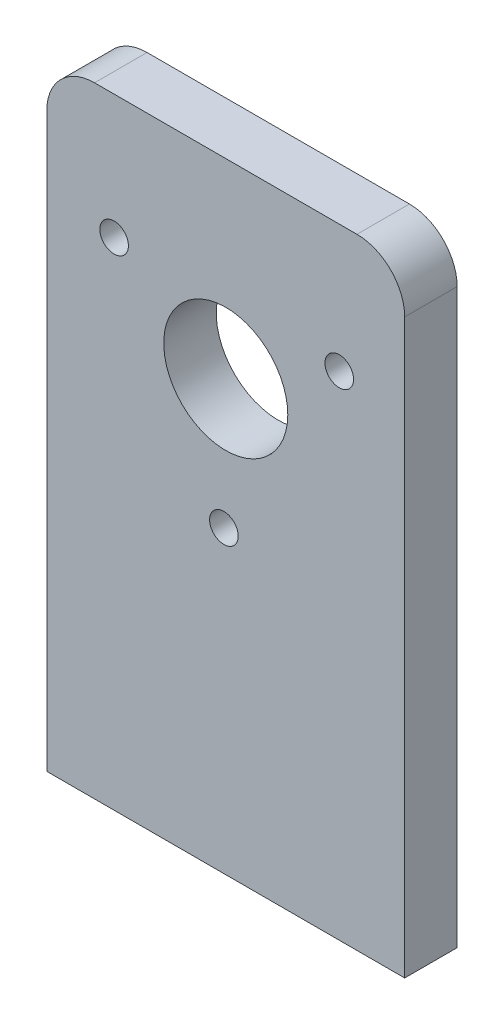
from build123d import *

# Parameters (mm, degrees)
SKETCH2_R           = 13
SKETCH2_R_2         = 3
BOSS_EXTRUDE1_DEPTH = 11


with BuildPart() as part:
    # Sketch2 → Boss-Extrude1 (new body)
    with BuildSketch(Plane.XY):
        with BuildLine():
            Line((0, 0), (75, 0))
            Line((75, 0), (75, 120))
            ThreePointArc((75, 120), (72.071067812, 127.071067812), (65, 130))
            Line((65, 130), (10, 130))
            ThreePointArc((10, 130), (2.928932188, 127.071067812), (0, 120))
            Line((0, 120), (0, 0))
        make_face()
        with Locations((37.5, 90)):
            Circle(SKETCH2_R, mode=Mode.SUBTRACT)
        with Locations((61.291446946, 103.286442421)):
            Circle(SKETCH2_R_2, mode=Mode.SUBTRACT)
        with Locations((14.097879865, 103.960776238)):
            Circle(SKETCH2_R_2, mode=Mode.SUBTRACT)
        with Locations((37.110673189, 62.752781341)):
            Circle(SKETCH2_R_2, mode=Mode.SUBTRACT)
    extrude(amount=BOSS_EXTRUDE1_DEPTH)


solid = part.part
